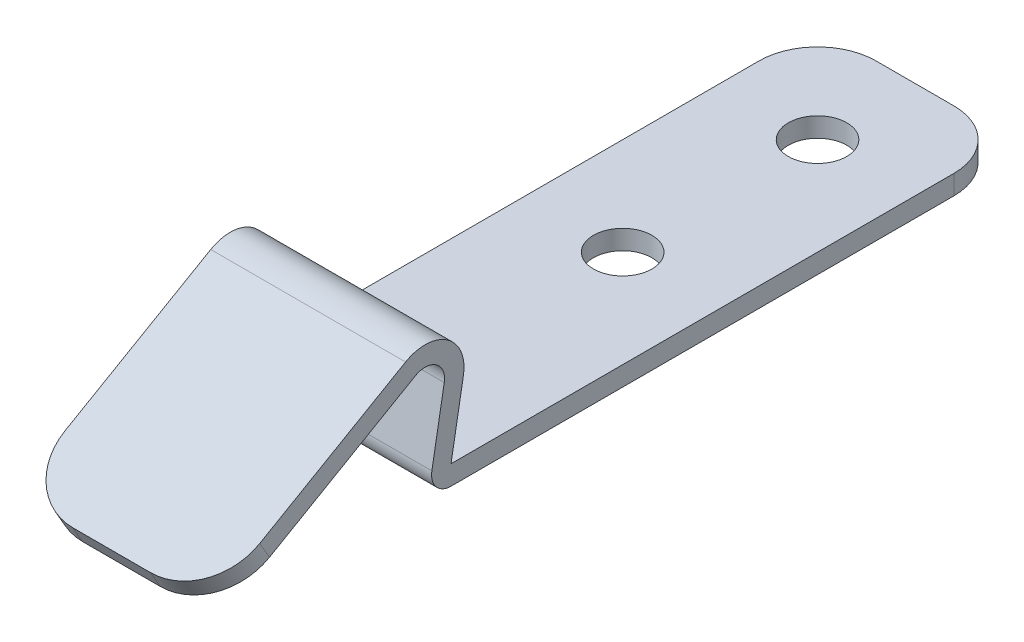
from build123d import *

# Parameters (mm, degrees)
EXTRUDE_THIN1_DEPTH = 5
FILLET1_R           = 3
SKETCH2_R           = 1.5
CUT_EXTRUDE1_DEPTH  = 10


with BuildPart() as part:
    # Sketch1 → Extrude-Thin1 (new, symmetric)
    with BuildSketch(Plane(origin=(0, 0, 0), x_dir=(0, 0, -1), z_dir=(1, 0, 0))):
        with BuildLine():
            Line((0, 0), (-28.808246407, 0))
            ThreePointArc((-28.808246407, 0), (-29.574290851, 0.35721239), (-29.79305416, 1.173648178))
            Line((-29.79305416, 1.173648178), (-29.156852475, 4.781727229))
            ThreePointArc((-29.156852475, 4.781727229), (-29.568083792, 5.774527451), (-30.641660228, 5.821400811))
            Line((-30.641660228, 5.821400811), (-40.724622204, 0))
            Line((-40.724622204, 0), (-41.224622204, 0.866025404))
            Line((-41.224622204, 0.866025404), (-31.141660228, 6.687426215))
            ThreePointArc((-31.141660228, 6.687426215), (-28.994507355, 6.593679496), (-28.172044722, 4.608079052))
            Line((-28.172044722, 4.608079052), (-28.808246407, 1))
            Line((-28.808246407, 1), (0, 1))
            Line((0, 1), (0, 0))
        make_face()
    extrude(amount=EXTRUDE_THIN1_DEPTH, both=True)

    # Fillet1
    fillet1_edges = [part.edges().sort_by_distance(p)[0] for p in [
        (-5, 0.433012702, 40.974622204),
        (5, 0.5, 0),
        (5, 0.433012702, 40.974622204),
        (-5, 0.5, 0),
    ]]
    fillet(fillet1_edges, radius=FILLET1_R)

    # Sketch2 → Cut-Extrude1 (cut)
    with BuildSketch(Plane(origin=(0, 1, 0), x_dir=(1, 0, 0), z_dir=(0, 1, 0))):
        with Locations(Location((0, -5, 0), (0, 0, 270))):
            Circle(SKETCH2_R)
        with Locations(Location((0, -15, 0), (0, 0, 270))):
            Circle(SKETCH2_R)
    extrude(amount=-CUT_EXTRUDE1_DEPTH, mode=Mode.SUBTRACT)


solid = part.part
